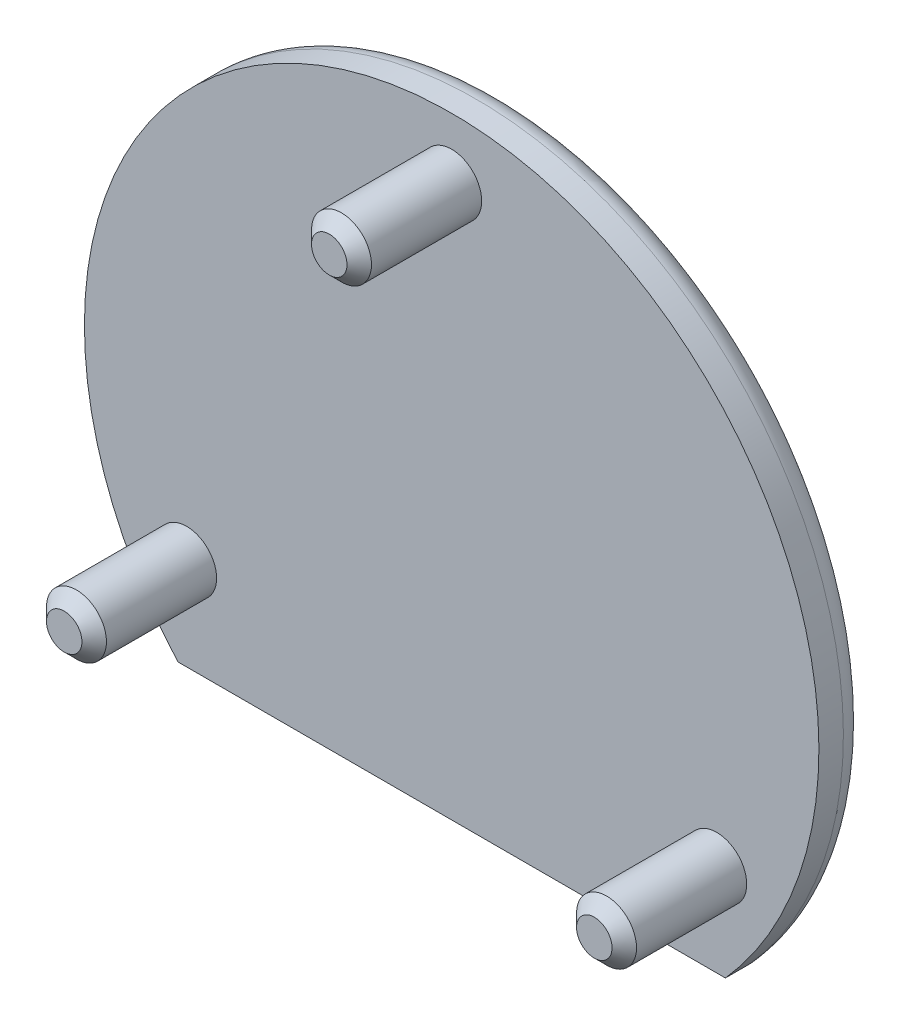
from build123d import *

# Parameters (mm, degrees)
SKETCH_1_R               = 30
EXTRUDE_1_DEPTH          = 4
SKETCH_2_R               = 2.45
EXTRUDE_2_DEPTH          = 10
CUT_EXTRUDE_1_DEPTH      = 45.676615807
CUT_EXTRUDE_1_DEPTH_BACK = 45.676615807
FILLET_1_R               = 2
CHAMFER_1_SIZE           = 1


with BuildPart() as part:
    # 스케치1 → 보스-돌출1 (new body)
    with BuildSketch(Plane.XY):
        Circle(SKETCH_1_R)
    extrude(amount=EXTRUDE_1_DEPTH)

    # 스케치2 → 보스-돌출2 (add)
    with BuildSketch(Plane.XY.offset(4)):
        with Locations((0, 25)):
            Circle(SKETCH_2_R)
        with Locations((21.650635095, -12.5)):
            Circle(SKETCH_2_R)
        with Locations((-21.650635095, -12.5)):
            Circle(SKETCH_2_R)
    extrude(amount=EXTRUDE_2_DEPTH)

    # 스케치3 → 컷-돌출1 (cut, two sides: drawn at the far end of the back side and taken through both)
    with BuildSketch(Plane(origin=(0, 0, 0), x_dir=(-1, 0, 0), z_dir=(0, 0, -1)).offset(-CUT_EXTRUDE_1_DEPTH_BACK)):
        with BuildLine():
            Line((22.360679775, -20), (-22.360679775, -20))
            ThreePointArc((-22.360679775, -20), (0, -30), (22.360679775, -20))
        make_face()
    extrude(amount=CUT_EXTRUDE_1_DEPTH + CUT_EXTRUDE_1_DEPTH_BACK, mode=Mode.SUBTRACT)

    # 필렛1
    fillet_1_edges = [part.edges().sort_by_distance(p)[0] for p in [
        (0, 30, 0),
        (0, -20, 0),
    ]]
    fillet(fillet_1_edges, radius=FILLET_1_R)

    # 모따기1
    chamfer_1_edges = [part.edges().sort_by_distance(p)[0] for p in [
        (-24.100635095, -12.5, 14),
        (-2.45, 25, 14),
        (19.200635095, -12.5, 14),
    ]]
    chamfer(chamfer_1_edges, length=CHAMFER_1_SIZE)


solid = part.part
